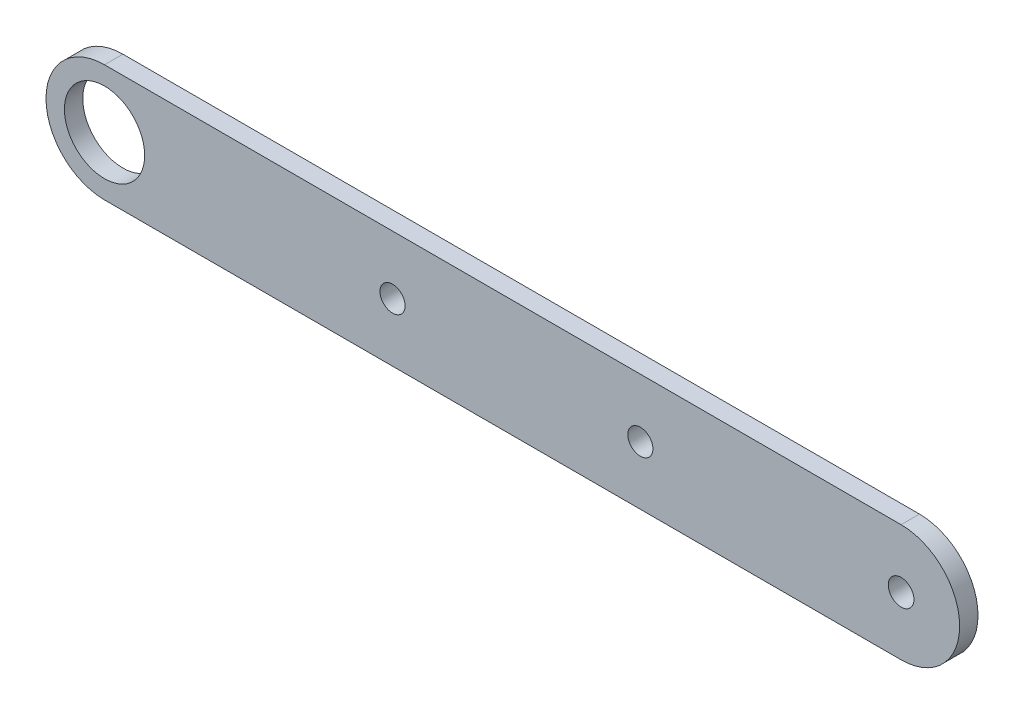
from build123d import *

# Parameters (mm, degrees)
ESQUISSE1_R        = 2.1
ESQUISSE1_R_2      = 6.55
ESQUISSE1_R_3      = 2.05
BOSS_EXTRU_1_DEPTH = 3


with BuildPart() as part:
    # Esquisse1 → Boss.-Extru.1 (new body)
    with BuildSketch(Plane.XY):
        with BuildLine():
            Line((-130, 9.55), (0, 9.55))
            ThreePointArc((0, 9.55), (9.55, 0), (0, -9.55))
            Line((0, -9.55), (-130, -9.55))
            ThreePointArc((-130, -9.55), (-139.55, 0), (-130, 9.55))
        make_face()
        Circle(ESQUISSE1_R, mode=Mode.SUBTRACT)
        with Locations((-130, 0)):
            Circle(ESQUISSE1_R_2, mode=Mode.SUBTRACT)
        with Locations((-83, 0)):
            Circle(ESQUISSE1_R_3, mode=Mode.SUBTRACT)
        with Locations((-42.55, 0)):
            Circle(ESQUISSE1_R_3, mode=Mode.SUBTRACT)
    extrude(amount=BOSS_EXTRU_1_DEPTH)


solid = part.part
